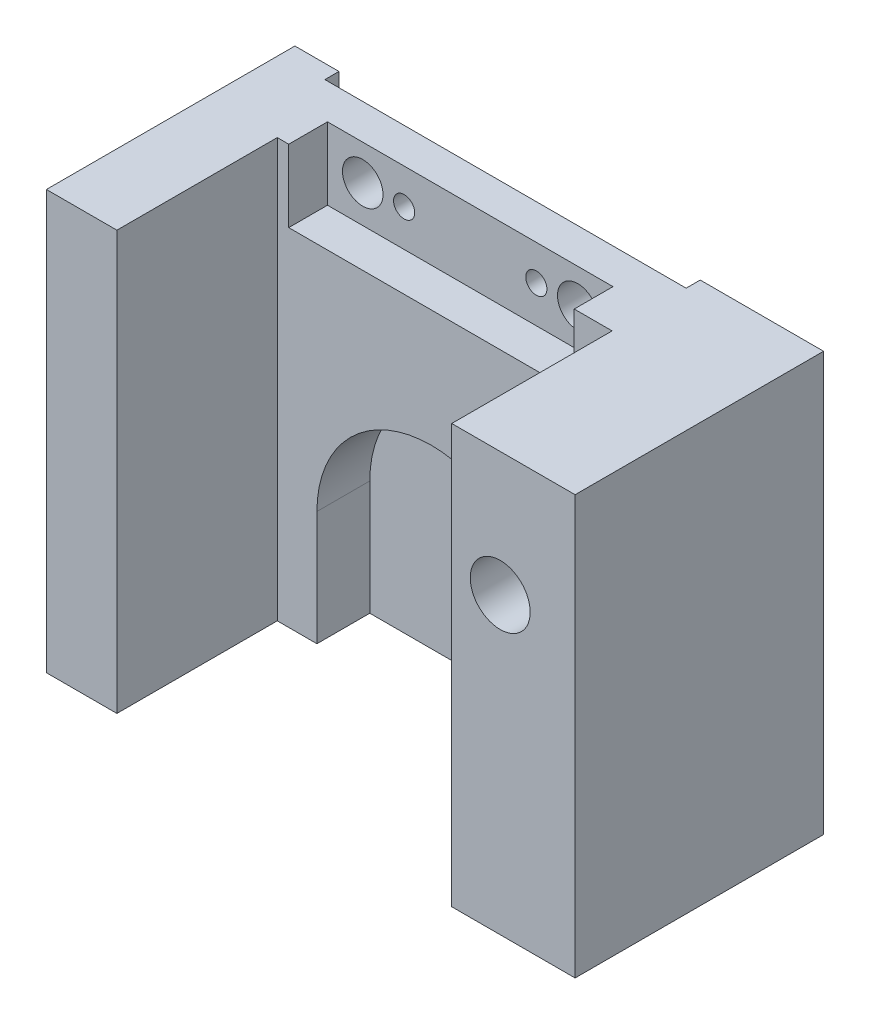
from build123d import *

# Parameters (mm, degrees)
SKETCH_1_W           = 30
SKETCH_1_H           = 28
EXTRUDE_1_DEPTH      = 10
CUT_EXTRUDE_2_DEPTH  = 0.8
M1_4X0_3_2_D         = 1.1
M1_4X0_3_2_DEPTH     = 3.7
M1_4X0_3_2_TIP       = 0.33047334
CUT_EXTRUDE_4_DEPTH  = 0.5
SKETCH_12_W          = 30
SKETCH_12_H          = 4.25
CUT_EXTRUDE_5_DEPTH  = 10
SKETCH_13_R          = 1.7
CUT_EXTRUDE_6_DEPTH  = 10
SKETCH_14_W          = 23
SKETCH_14_H          = 23.75
CUT_EXTRUDE_7_DEPTH  = 5
CUT_EXTRUDE_9_DEPTH  = 3
SKETCH_20_W          = 7
SKETCH_20_H          = 23.75
SKETCH_20_R          = 1.7
EXTRUDE_3_DEPTH      = 4.1
SKETCH_23_W          = 4
SKETCH_23_H          = 23.75
EXTRUDE_4_DEPTH      = 9.1
SKETCH_24_W          = 16.2
SKETCH_24_H          = 4.1
CUT_EXTRUDE_10_DEPTH = 5
SKETCH_29_W          = 16.2
SKETCH_29_H          = 2
EXTRUDE_5_DEPTH      = 4.1
SKETCH_30_R          = 1.15
SKETCH_30_R_2        = 0.6
CUT_EXTRUDE_12_DEPTH = 5


with BuildPart() as part:
    # 草图1 → 凸台-拉伸1 (new body)
    with BuildSketch(Plane.XY):
        with Locations((7.449728974, 2.736434109)):
            Rectangle(SKETCH_1_W, SKETCH_1_H)
    extrude(amount=EXTRUDE_1_DEPTH)

    # 草图2 → 切除-拉伸2 (cut)
    with BuildSketch(Plane(origin=(0, 0, 0), x_dir=(-1, 0, 0), z_dir=(0, 0, -1))):
        with BuildLine():
            Line((5.050271026, 16.736434109), (-15.449728974, 16.736434109))
            Line((-15.449728974, 16.736434109), (-15.449728974, 3.736434109))
            ThreePointArc((-15.449728974, 3.736434109), (-14.571049317, 1.615113765), (-12.449728974, 0.736434109))
            Line((-12.449728974, 0.736434109), (2.050271026, 0.736434109))
            ThreePointArc((2.050271026, 0.736434109), (4.17159137, 1.615113765), (5.050271026, 3.736434109))
            Line((5.050271026, 3.736434109), (5.050271026, 16.736434109))
        make_face()
    extrude(amount=-CUT_EXTRUDE_2_DEPTH, mode=Mode.SUBTRACT)

    # M1.4x0.3 螺纹孔2
    with Locations(Plane(origin=(0, 0, 0.8), x_dir=(-1, 0, 0), z_dir=(0, 0, -1))):
        with Locations((-12.199728974, 8.736434109), (1.800271026, 8.736434109)):
            Hole(M1_4X0_3_2_D / 2, depth=M1_4X0_3_2_DEPTH)
            with Locations((0, 0, -(M1_4X0_3_2_DEPTH + M1_4X0_3_2_TIP / 2))):  # 118° drill point
                Cone(0, M1_4X0_3_2_D / 2, M1_4X0_3_2_TIP, mode=Mode.SUBTRACT)

    # 草图11 → 切除-拉伸4 (cut)
    with BuildSketch(Plane(origin=(0, 0, 0), x_dir=(-1, 0, 0), z_dir=(0, 0, -1))):
        with BuildLine():
            Line((-7.549728974, -2.063565891), (-2.849728974, -2.063565891))
            ThreePointArc((-2.849728974, -2.063565891), (-2.422952278, -2.240342587), (-2.599728974, -1.813565891))
            Line((-2.599728974, -1.813565891), (-2.599728974, 0.736434109))
            Line((-2.599728974, 0.736434109), (-7.799728974, 0.736434109))
            Line((-7.799728974, 0.736434109), (-7.799728974, -1.813565891))
            ThreePointArc((-7.799728974, -1.813565891), (-7.976505669, -2.240342587), (-7.549728974, -2.063565891))
        make_face()
    extrude(amount=-CUT_EXTRUDE_4_DEPTH, mode=Mode.SUBTRACT)

    # 草图12 → 切除-拉伸5 (cut)
    with BuildSketch(Plane(origin=(0, 0, 0), x_dir=(-1, 0, 0), z_dir=(0, 0, -1))):
        with Locations((-7.449728974, -9.138565891)):
            Rectangle(SKETCH_12_W, SKETCH_12_H)
    extrude(amount=-CUT_EXTRUDE_5_DEPTH, mode=Mode.SUBTRACT)

    # 草图13 → 切除-拉伸6 (cut)
    with BuildSketch(Plane(origin=(0, 0, 0), x_dir=(-1, 0, 0), z_dir=(0, 0, -1))):
        with Locations((-18.199728974, 9.686434109)):
            Circle(SKETCH_13_R)
    extrude(amount=-CUT_EXTRUDE_6_DEPTH, mode=Mode.SUBTRACT)

    # 草图14 → 切除-拉伸7 (cut)
    with BuildSketch(Plane.XY.offset(10)):
        with Locations((3.949728974, 4.861434109)):
            Rectangle(SKETCH_14_W, SKETCH_14_H)
    extrude(amount=-CUT_EXTRUDE_7_DEPTH, mode=Mode.SUBTRACT)

    # 草图16 → 切除-拉伸9 (cut)
    with BuildSketch(Plane.XY.offset(5)):
        with BuildLine():
            Line((-1.300271026, -7.013565891), (11.699728974, -7.013565891))
            Line((11.699728974, -7.013565891), (11.699728974, -0.513565891))
            ThreePointArc((11.699728974, -0.513565891), (5.199728974, 5.986434109), (-1.300271026, -0.513565891))
            Line((-1.300271026, -0.513565891), (-1.300271026, -7.013565891))
        make_face()
    extrude(amount=-CUT_EXTRUDE_9_DEPTH, mode=Mode.SUBTRACT)

    # 草图20 → 凸台-拉伸3 (add)
    with BuildSketch(Plane.XY.offset(10)):
        with Locations((18.949728974, 4.861434109)):
            Rectangle(SKETCH_20_W, SKETCH_20_H)
        with Locations(Location((18.199728974, 9.686434109, 0), (0, 0, 180))):
            Circle(SKETCH_20_R, mode=Mode.SUBTRACT)
    extrude(amount=EXTRUDE_3_DEPTH)

    # 草图23 → 凸台-拉伸4 (add)
    with BuildSketch(Plane.XY.offset(5)):
        with Locations((-5.550271026, 4.861434109)):
            Rectangle(SKETCH_23_W, SKETCH_23_H)
    extrude(amount=EXTRUDE_4_DEPTH)

    # 草图24 → 切除-拉伸10 (cut)
    with BuildSketch(Plane(origin=(0, 0, 0.8), x_dir=(-1, 0, 0), z_dir=(0, 0, -1))):
        with Locations((-5.199728974, 14.686434109)):
            Rectangle(SKETCH_24_W, SKETCH_24_H)
    extrude(amount=-CUT_EXTRUDE_10_DEPTH, mode=Mode.SUBTRACT)

    # 草图29 → 凸台-拉伸5 (add)
    with BuildSketch(Plane(origin=(0, 12.636434109, 0), x_dir=(1, 0, 0), z_dir=(0, 1, 0))):
        with Locations((5.199728974, -1.8)):
            Rectangle(SKETCH_29_W, SKETCH_29_H)
    extrude(amount=EXTRUDE_5_DEPTH)

    # 草图30 → 切除-拉伸12 (cut)
    with BuildSketch(Plane(origin=(0, 0, 0.8), x_dir=(-1, 0, 0), z_dir=(0, 0, -1))):
        with Locations((0.900271026, 14.736434109)):
            Circle(SKETCH_30_R)
        with Locations((-11.299728974, 14.736434109)):
            Circle(SKETCH_30_R)
        with Locations((-1.449728974, 14.736434109)):
            Circle(SKETCH_30_R_2)
        with Locations((-8.949728974, 14.736434109)):
            Circle(SKETCH_30_R_2)
    extrude(amount=-CUT_EXTRUDE_12_DEPTH, mode=Mode.SUBTRACT)


solid = part.part
